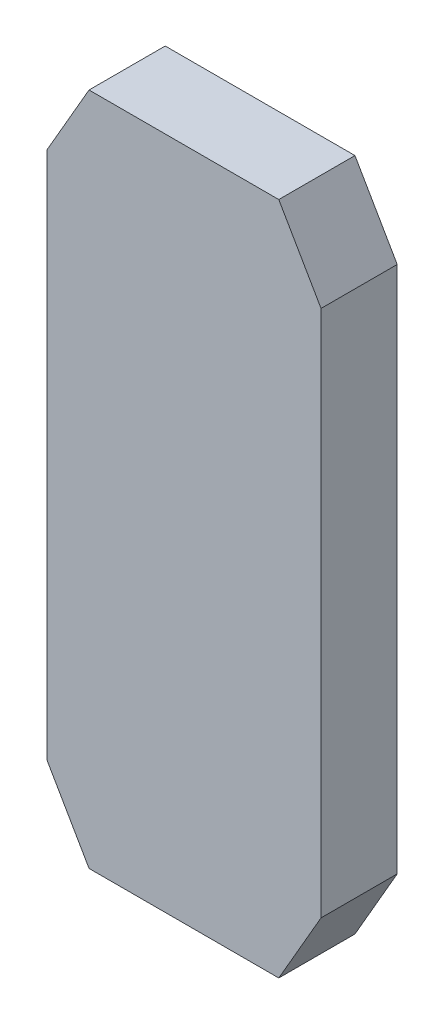
from build123d import *

# Parameters (mm, degrees)
BOSS_EXTRUDE1_DEPTH = 5
SHELL1_T            = -1.5


with BuildPart() as part:
    # Sketch1 → Boss-Extrude1 (new body)
    with BuildSketch(Plane.XY):
        Polygon((6.226497308, -22.124355653), (9, -17.320508076), (9, 17.320508076), (6.226497308, 22.124355653), (-6.226497308, 22.124355653), (-9, 17.320508076), (-9, -17.320508076), (-6.226497308, -22.124355653), align=None)
    extrude(amount=-BOSS_EXTRUDE1_DEPTH)

    # Shell1
    shell1_openings = [part.faces().sort_by_distance(p)[0] for p in [
        (0, 0, -5),
    ]]
    offset(amount=SHELL1_T, openings=shell1_openings, kind=Kind.INTERSECTION)


solid = part.part
